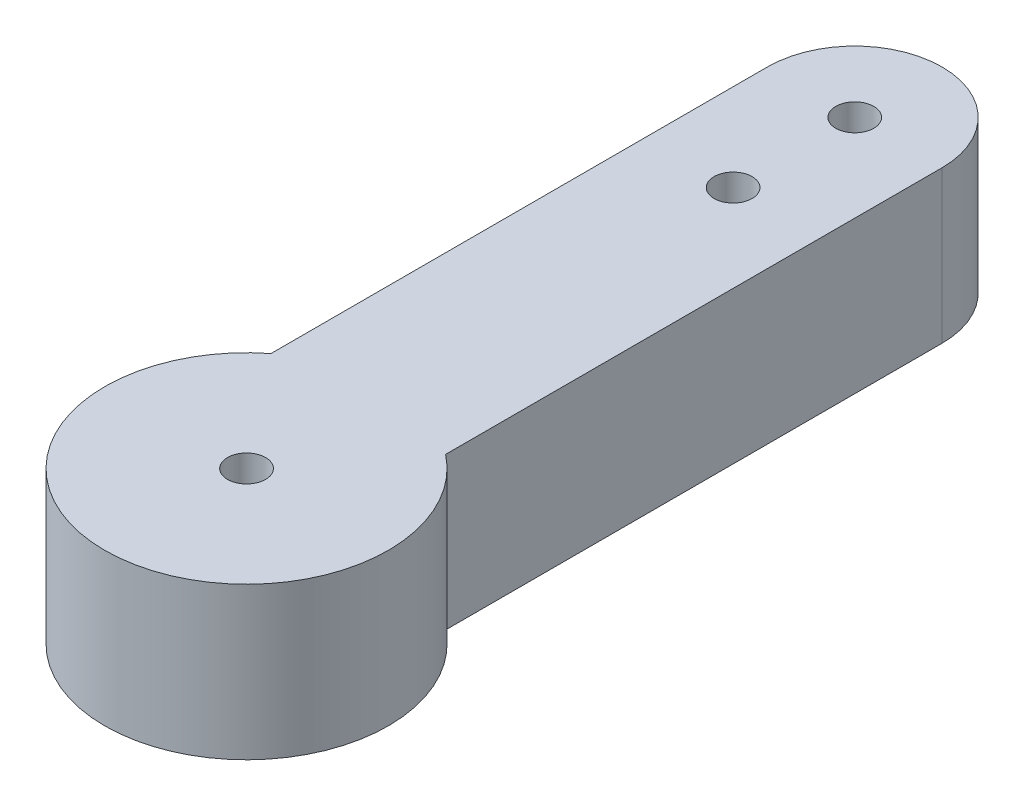
from build123d import *

# Parameters (mm, degrees)
SKETCH1_R           = 5.922468873
SKETCH1_R_2         = 4.194729015
SKETCH1_R_3         = 0.79375
BOSS_EXTRUDE1_DEPTH = 6.35


with BuildPart() as part:
    # Sketch1 → Boss-Extrude1 (new body)
    # profile 1 of 3: a face of its own
    with BuildSketch(Plane(origin=(0, 0, 0), x_dir=(1, 0, 0), z_dir=(0, 1, 0))):
        Circle(SKETCH1_R)
        Circle(SKETCH1_R_2, mode=Mode.SUBTRACT)
    # profile 2 of 3: a face of its own
    with BuildSketch(Plane(origin=(0, 0, 0), x_dir=(1, 0, 0), z_dir=(0, 1, 0))):
        Circle(SKETCH1_R_2)
        with Locations(Location((0, 0, 0), (0, 0, 270))):
            Circle(SKETCH1_R_3, mode=Mode.SUBTRACT)
    # profile 3 of 3: a face of its own
    with BuildSketch(Plane(origin=(0, 0, 0), x_dir=(1, 0, 0), z_dir=(0, 1, 0))):
        with BuildLine():
            ThreePointArc((3.646669154, 25.4), (0, 29.046669154), (-3.646669154, 25.4))
            Line((-3.646669154, 25.4), (-3.646669154, 4.666630651))
            ThreePointArc((-3.646669154, 4.666630651), (0, 5.922468873), (3.646669154, 4.666630651))
            Line((3.646669154, 4.666630651), (3.646669154, 25.4))
        make_face()
        with Locations(Location((0, 20.32, 0), (0, 0, 270))):
            Circle(SKETCH1_R_3, mode=Mode.SUBTRACT)
        with Locations(Location((0, 25.4, 0), (0, 0, 270))):
            Circle(SKETCH1_R_3, mode=Mode.SUBTRACT)
    extrude(amount=BOSS_EXTRUDE1_DEPTH)


solid = part.part
